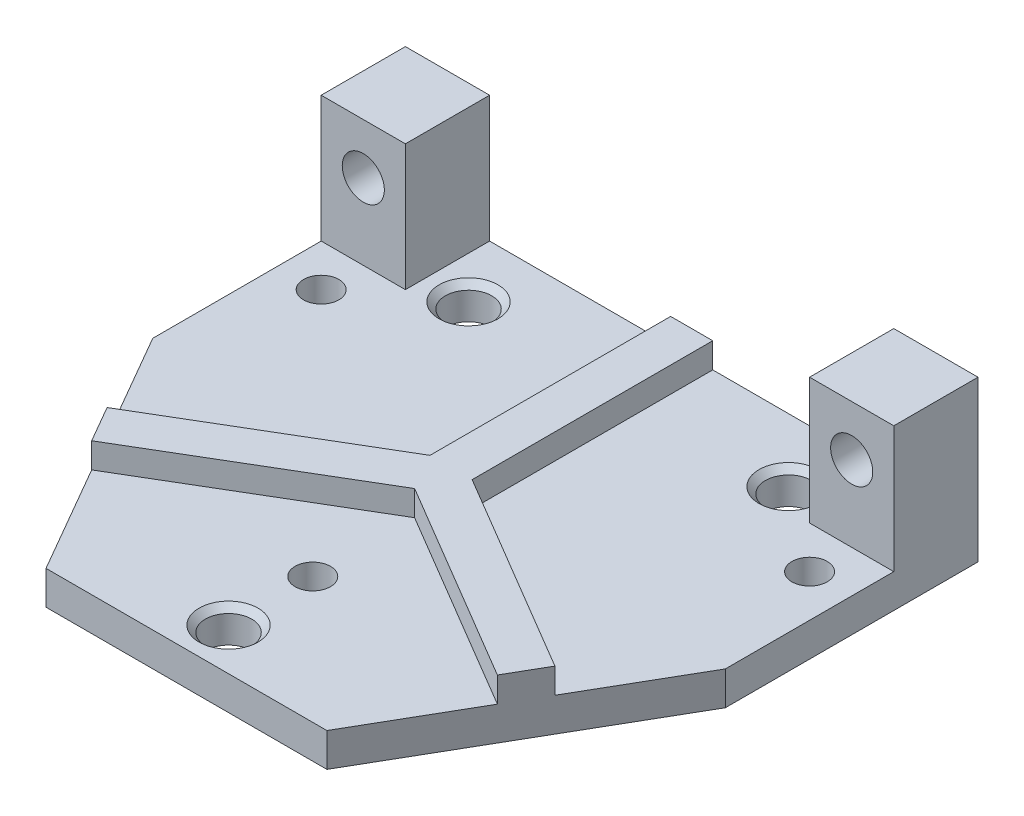
from build123d import *

# Parameters (mm, degrees)
SKETCH1_R           = 2.75
SKETCH1_R_2         = 2.1
BOSS_EXTRUDE1_DEPTH = 4
BOSS_EXTRUDE2_DEPTH = 3
SKETCH3_W           = 10
SKETCH3_H           = 10
BOSS_EXTRUDE3_DEPTH = 15
SKETCH4_R           = 2.5
CUT_EXTRUDE1_DEPTH  = 72.533209071
CHAMFER1_SIZE       = 0.75


with BuildPart() as part:
    # Sketch1 → Boss-Extrude1 (new body)
    with BuildSketch(Plane(origin=(0, 0, 0), x_dir=(1, 0, 0), z_dir=(0, 1, 0))):
        Polygon((-16.679491924, -30), (16.679491924, -30), (34, 0), (34, 30), (-34, 30), (-34, 0), align=None)
        with Locations(Location((-19, 22.5, 0), (0, 0, 270))):
            Circle(SKETCH1_R, mode=Mode.SUBTRACT)
        with Locations(Location((19, 22.5, 0), (0, 0, 270))):
            Circle(SKETCH1_R, mode=Mode.SUBTRACT)
        with Locations(Location((0, -25, 0), (0, 0, 270))):
            Circle(SKETCH1_R, mode=Mode.SUBTRACT)
        with Locations(Location((-29, 15, 0), (0, 0, 270))):
            Circle(SKETCH1_R_2, mode=Mode.SUBTRACT)
        with Locations(Location((29, 15, 0), (0, 0, 270))):
            Circle(SKETCH1_R_2, mode=Mode.SUBTRACT)
        with Locations(Location((0, -15, 0), (0, 0, 270))):
            Circle(SKETCH1_R_2, mode=Mode.SUBTRACT)
    extrude(amount=BOSS_EXTRUDE1_DEPTH)

    # Sketch2 → Boss-Extrude2 (add)
    with BuildSketch(Plane(origin=(0, 4, 0), x_dir=(1, 0, 0), z_dir=(0, 1, 0))):
        Polygon((-26.589820012, -12.834808232), (-24.089671912, -17.165191768), (0, -2.905179879), (24.089671912, -17.165191768), (26.589820012, -12.834808232), (2.5, 1.425291326), (2.5, 30), (-2.5, 30), (-2.5, 1.425291326), align=None)
    extrude(amount=BOSS_EXTRUDE2_DEPTH)

    # Sketch3 → Boss-Extrude3 (add)
    with BuildSketch(Plane(origin=(0, 4, 0), x_dir=(1, 0, 0), z_dir=(0, 1, 0))):
        with Locations((-29, 25)):
            Rectangle(SKETCH3_W, SKETCH3_H)
        with Locations((29, 25)):
            Rectangle(SKETCH3_W, SKETCH3_H)
    extrude(amount=BOSS_EXTRUDE3_DEPTH)

    # Sketch4 → Cut-Extrude1 (cut, through all)
    with BuildSketch(Plane(origin=(0, 0, -30), x_dir=(-1, 0, 0), z_dir=(0, 0, -1))):
        with Locations((-29, 13)):
            Circle(SKETCH4_R)
        with Locations((29, 13)):
            Circle(SKETCH4_R)
    extrude(amount=-CUT_EXTRUDE1_DEPTH, mode=Mode.SUBTRACT)

    # Chamfer1
    chamfer1_edges = [part.edges().sort_by_distance(p)[0] for p in [
        (-19, 4, -25.25),
        (19, 4, -25.25),
        (0, 4, 22.25),
    ]]
    chamfer(chamfer1_edges, length=CHAMFER1_SIZE)


solid = part.part
